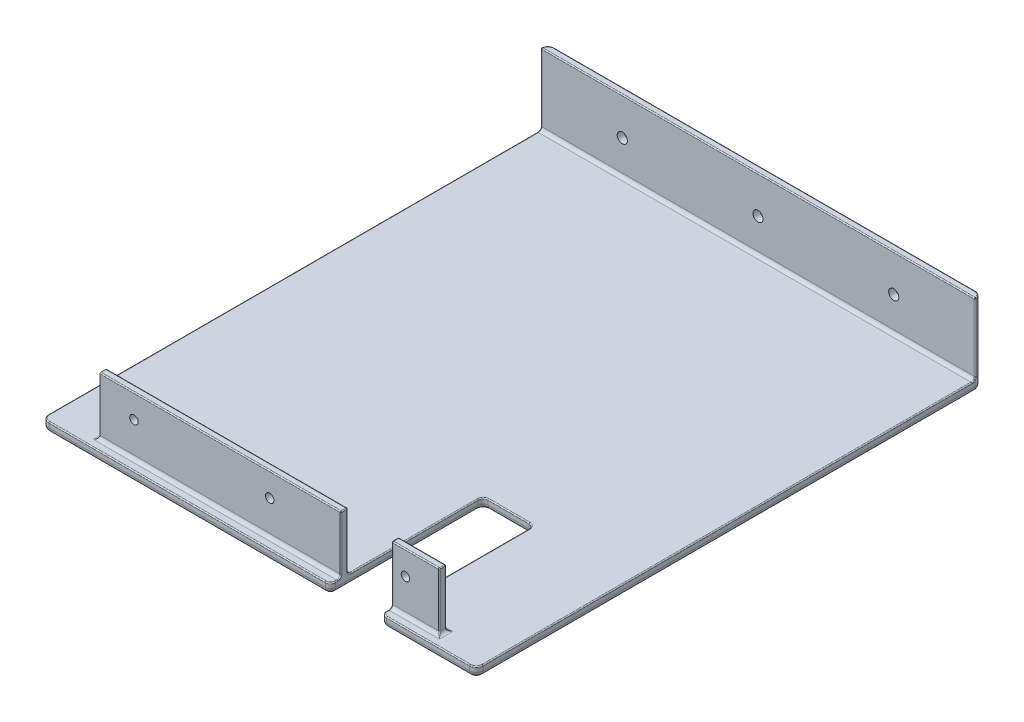
from build123d import *

# Parameters (mm, degrees)
EXTRUDE_1_DEPTH     = 3
EXTRUDE_2_DEPTH     = 2
EXTRUDE_START       = -3.1
SKETCH_4_W          = 100.00000000000001
SKETCH_4_H          = 20
EXTRUDE_3_DEPTH     = 2
CUT_EXTRUDE_1_REACH = 103.105
CUT_EXTRUDE_2_REACH = 165.93
SKETCH_6_R          = 1.5000000000000042
SKETCH_6_R_2        = 1.4999999999999998
HOLE_WIZARD_M3_3_D  = 2.5
FILLET_4_R          = 2
FILLET_1_R          = 1.5
FILLET_2_R          = 1
FILLET_3_R          = 0.3


with BuildPart() as part:
    # 草图1 → 凸台-拉伸1 (new body)
    with BuildSketch(Plane(origin=(0, 0, 0), x_dir=(1, 0, 0), z_dir=(0, 1, 0))):
        Polygon((64, 74.5), (-63.999999999999986, 74.49999999999999), (-63.99999999999997, -74.50000000000001), (64.00000000000003, -74.49999999999999), align=None)
    extrude(amount=EXTRUDE_1_DEPTH)

    # 草图3 → 凸台-拉伸2 (add)
    with BuildSketch(Plane(origin=(-8.08e-15, 0, -74.49999999999999), x_dir=(-1, 0, 1.1e-16), z_dir=(-1.1e-16, 0, -1))):
        Polygon((63.99999999999997, 0), (-64.00000000000001, 0), (-64.00000000000001, 23.999999999999982), (63.99999999999997, 23.999999999999996), align=None)
    extrude(amount=-EXTRUDE_2_DEPTH)

    # 草图4 → 凸台-拉伸3 (add)
    with BuildSketch(Plane.XY.offset(74.5).offset(EXTRUDE_START)):
        with Locations((0, 10)):
            Rectangle(SKETCH_4_W, SKETCH_4_H)
    extrude(amount=-EXTRUDE_3_DEPTH)

    # 草图5 → 切除-拉伸1 (cut, up to next)
    with BuildSketch(Plane.XZ, mode=Mode.PRIVATE) as cut_extrude_1_sk1:
        Polygon((36.00000000000003, 74.50000000000001), (21.000000000000032, 74.50000000000001), (21.00000000000004, 29.500000000000014), (36.000000000000036, 29.500000000000018), align=None)
    cut_extrude_1_tool1 = extrude(cut_extrude_1_sk1.sketch, amount=-CUT_EXTRUDE_1_REACH, mode=Mode.PRIVATE) & part.part
    add(cut_extrude_1_tool1.solids().sort_by_distance((28.5, 0, 52))[0], mode=Mode.SUBTRACT)

    # 草图6 → 切除-拉伸2 (cut, up to next)
    with BuildSketch(Plane(origin=(-8.08e-15, 0, -74.49999999999999), x_dir=(-1, 0, 1.1e-16), z_dir=(-1.1e-16, 0, -1)), mode=Mode.PRIVATE) as cut_extrude_2_sk1:
        with Locations((40, 13)):
            Circle(SKETCH_6_R)
    cut_extrude_2_tool1 = extrude(cut_extrude_2_sk1.sketch, amount=-CUT_EXTRUDE_2_REACH, mode=Mode.PRIVATE) & part.part
    # 草图6 → 切除-拉伸2 (cut, up to next)
    with BuildSketch(Plane(origin=(-8.08e-15, 0, -74.49999999999999), x_dir=(-1, 0, 1.1e-16), z_dir=(-1.1e-16, 0, -1)), mode=Mode.PRIVATE) as cut_extrude_2_sk2:
        with Locations((-40.00000000000003, 13)):
            Circle(SKETCH_6_R)
    cut_extrude_2_tool2 = extrude(cut_extrude_2_sk2.sketch, amount=-CUT_EXTRUDE_2_REACH, mode=Mode.PRIVATE) & part.part
    # 草图6 → 切除-拉伸2 (cut, up to next)
    with BuildSketch(Plane(origin=(-8.08e-15, 0, -74.49999999999999), x_dir=(-1, 0, 1.1e-16), z_dir=(-1.1e-16, 0, -1)), mode=Mode.PRIVATE) as cut_extrude_2_sk3:
        with Locations((-1.388e-14, 13)):
            Circle(SKETCH_6_R_2)
    cut_extrude_2_tool3 = extrude(cut_extrude_2_sk3.sketch, amount=-CUT_EXTRUDE_2_REACH, mode=Mode.PRIVATE) & part.part
    add(cut_extrude_2_tool1.solids().sort_by_distance((-40, 13, -74.5))[0], mode=Mode.SUBTRACT)
    add(cut_extrude_2_tool2.solids().sort_by_distance((40, 13, -74.5))[0], mode=Mode.SUBTRACT)
    add(cut_extrude_2_tool3.solids().sort_by_distance((0, 13, -74.5))[0], mode=Mode.SUBTRACT)

    # M3 螺纹孔3 (through all)
    with Locations(Plane.XY.offset(71.39999999999999)):
        with Locations((40, 13), (0, 13), (-40, 13)):
            Hole(HOLE_WIZARD_M3_3_D / 2)

    # 圆角4
    fillet_4_edges = [part.edges().sort_by_distance(p)[0] for p in [
        (64, 11.999999999999991, -74.5),
        (-63.99999999999998, 11.999999999999998, -74.49999999999999),
        (-63.99999999999997, 1.5, 74.50000000000001),
        (64.00000000000003, 1.5, 74.49999999999999),
    ]]
    fillet(fillet_4_edges, radius=FILLET_4_R)

    # 圆角1
    fillet_1_edges = [part.edges().sort_by_distance(p)[0] for p in [
        (7.11e-15, 0, -74.5),
        (-20.49999999999997, 0, 74.5),
        (-63.99999999999997, 0, 2.842e-14),
        (64.00000000000001, 0, -1.421e-14),
        (63.41421356237312, 0, 73.91421356237308),
        (-63.414213562373064, 0, 73.9142135623731),
        (-63.41421356237308, 0, -73.91421356237306),
        (63.41421356237309, 8.4e-16, -73.9142135623731),
        (49.00000000000003, 0, 74.49999999999999),
        (36.00000000000003, 1.5, 74.50000000000001),
        (36.000000000000036, 1.5, 29.500000000000018),
        (21.00000000000004, 1.5, 29.500000000000014),
        (21.000000000000032, 1.5, 74.50000000000001),
        (36.00000000000003, 0, 52.000000000000014),
        (21.000000000000036, 0, 52.000000000000014),
        (28.500000000000036, 0, 29.500000000000014),
    ]]
    fillet(fillet_1_edges, radius=FILLET_1_R)

    # 圆角2
    fillet_2_edges = [part.edges().sort_by_distance(p)[0] for p in [
        (1.568e-14, 3, -72.49999999999999),
        (43.00000000000003, 3, 69.4),
        (50.000000000000014, 3, 70.4),
        (-49.999999999999986, 3, 70.4),
        (43.00000000000003, 3, 71.4),
        (-14.499999999999975, 3, 71.4),
        (-14.499999999999975, 3, 69.4),
    ]]
    fillet(fillet_2_edges, radius=FILLET_2_R)

    # 圆角3
    fillet_3_edges = [part.edges().sort_by_distance(p)[0] for p in [
        (36.00000000000003, 12, 69.4),
        (36.00000000000003, 3.2928932188134525, 69.10710678118656),
        (36.000000000000036, 3, 49.70000000000002),
        (35.560660171779865, 3, 29.939339828220195),
        (28.50000000000004, 3, 29.500000000000018),
        (21.439339828220216, 3, 29.93933982822019),
        (21.000000000000032, 3, 49.70000000000001),
        (21.000000000000032, 3.2928932188134525, 69.10710678118656),
        (-63.999999999999986, 3.2928932188134525, -72.20710678118654),
        (-63.99999999999998, 3, 0.5000000000000142),
        (-21.24999999999997, 3, 74.5),
        (20.56066017177985, 3, 74.06066017177982),
        (21.00000000000003, 3, 72.7),
        (21.000000000000032, 3.292893218813452, 71.69289321881345),
        (63.99999999999999, 3.2928932188134525, -72.20710678118655),
        (64.00000000000001, 3, 0.5),
        (49.75000000000003, 3, 74.49999999999999),
        (36.439339828220206, 3, 74.0606601717798),
        (36.000000000000036, 3, 72.69999999999999),
        (36.00000000000003, 3.292893218813452, 71.69289321881345),
        (50.35395109257979, 3.236703983227258, 69.04604890742023),
        (50.35395109257979, 3.236703983227258, 71.75395109257978),
        (21.000000000000036, 20, 70.4),
        (36.000000000000036, 20, 70.4),
        (50.000000000000014, 20, 70.4),
        (-14.499999999999977, 20, 69.4),
        (-14.499999999999977, 20, 71.4),
        (21.00000000000003, 12, 69.4),
        (21.00000000000003, 12, 71.4),
        (43.00000000000002, 20, 69.4),
        (36.00000000000003, 12, 71.4),
        (43.00000000000002, 20, 71.4),
        (50.000000000000014, 12, 69.4),
        (50.000000000000014, 12, 71.4),
        (4.7531e-13, 23.99999999999999, -72.49999999999999),
        (1.324e-14, 23.99999999999999, -74.49999999999999),
        (-63.41421356237308, 23.999999999999996, -73.91421356237306),
        (63.41421356237311, 23.999999999999982, -73.91421356237308),
        (-63.99999999999998, 13.999999999999998, -72.49999999999999),
        (-63.414213562373064, 3, 73.9142135623731),
        (64, 13.999999999999991, -72.49999999999999),
        (63.41421356237312, 3, 73.91421356237308),
    ]]
    fillet(fillet_3_edges, radius=FILLET_3_R)


solid = part.part
